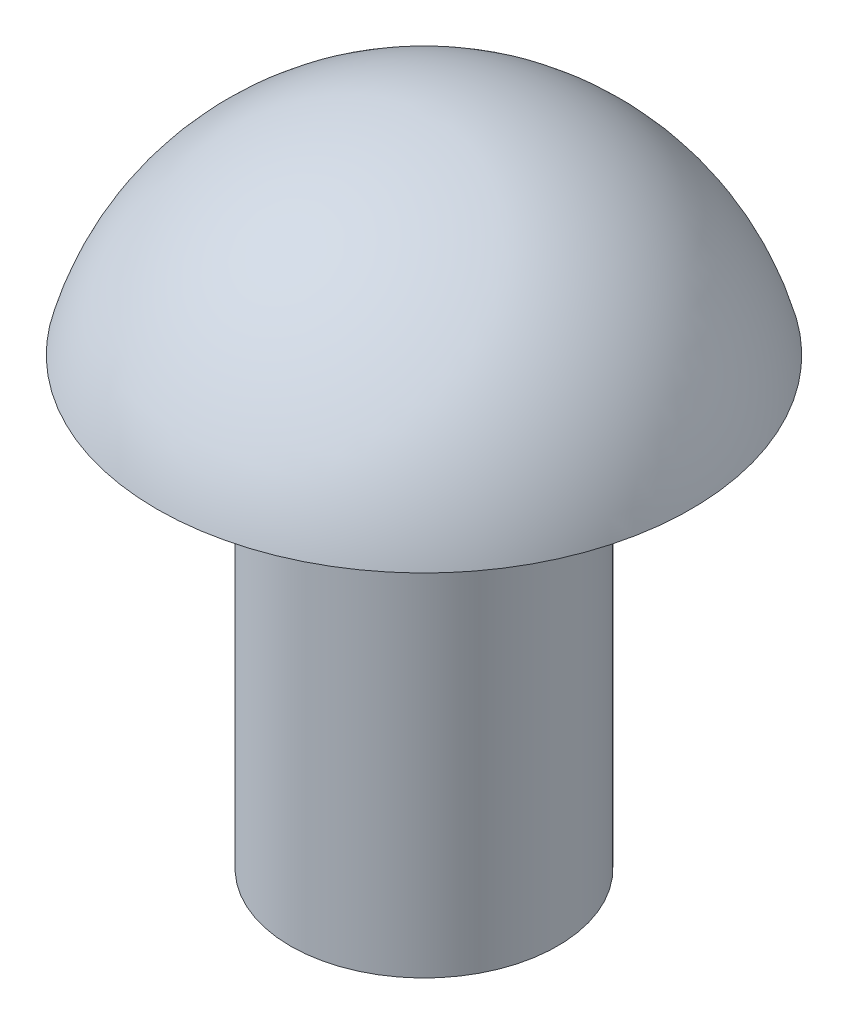
from build123d import *

# Parameters (mm, degrees)
SKETCH1_R           = 76.2
BOSS_EXTRUDE1_DEPTH = 254
SCALE1_SCALE        = 0.0393701


with BuildPart() as part:
    # Sketch1 → Boss-Extrude1 (new body)
    with BuildSketch(Plane(origin=(0, 0, 0), x_dir=(1, 0, 0), z_dir=(0, 1, 0))):
        with Locations(Location((0, 0, 0), (0, 0, 270))):
            Circle(SKETCH1_R)
    extrude(amount=BOSS_EXTRUDE1_DEPTH)

    # Sketch2 → Revolve3 (revolve)
    with BuildSketch(Plane(origin=(0, 0, 0), x_dir=(0, 0, -1), z_dir=(1, 0, 0)), mode=Mode.PRIVATE) as revolve3_sk:
        with BuildLine():
            Line((0, 371.361992924), (0, 254))
            Line((0, 254), (76.2, 254))
            Line((76.2, 254), (152.4, 254))
            ThreePointArc((152.4, 254), (96.176397031, 338.621276033), (0, 371.361992924))
        make_face()
    revolve(revolve3_sk.sketch.rotate(Axis((0, 254, 0), (0, 1, 0)), 180), axis=Axis((0, 254, 0), (0, 1, 0)))


with BuildPart() as part_1:
    # Scale1: scaled about (0, 215.966552743, 0)
    add(part.part.scale(SCALE1_SCALE).moved(Location((0, 207.463927965, 0))))


solid = part_1.part
